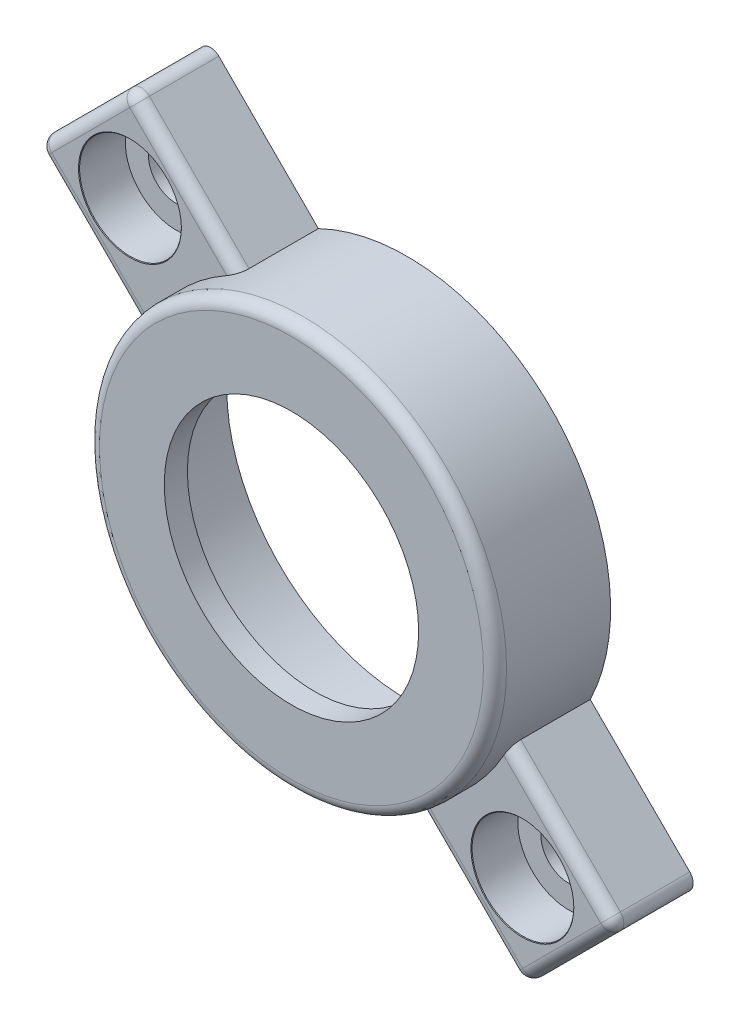
from build123d import *

# Parameters (mm, degrees)
SKETCH1_R                     = 8.8
BOSS_EXTRUDE1_DEPTH           = 5
SHELL1_T                      = -1
BOSS_EXTRUDE2_DEPTH           = 3.5
CBORE_FOR_M2_SHCS1_AT_2_COUNT = 2
CBORE_FOR_M2_SHCS1_AT_2_PITCH = 23.999204153
FILLET1_R                     = 0.5
SKETCH5_R                     = 5.5
CUT_EXTRUDE1_DEPTH            = 10


with BuildPart() as part:
    # Sketch1 → Boss-Extrude1 (new body)
    with BuildSketch(Plane.XY):
        Circle(SKETCH1_R)
    extrude(amount=BOSS_EXTRUDE1_DEPTH)

    # Shell1
    shell1_openings = [part.faces().sort_by_distance(p)[0] for p in [
        (0, 0, 0),
    ]]
    offset(amount=SHELL1_T, openings=shell1_openings, kind=Kind.INTERSECTION)

    # Sketch1<4> → Boss-Extrude2 (add)
    with BuildSketch(Plane.XY):
        with BuildLine():
            ThreePointArc((-7.919955614, 3.835922715), (-7.171229209, 5.100340344), (-6.222539674, 6.222539674))
            ThreePointArc((-6.222539674, 6.222539674), (-5.100340344, 7.171229209), (-3.835922715, 7.919955614))
            Line((-3.835922715, 7.919955614), (-8.49355603, 12.577588929))
            Line((-8.49355603, 12.577588929), (-12.577588929, 8.49355603))
            Line((-12.577588929, 8.49355603), (-7.919955614, 3.835922715))
        make_face()
        with BuildLine():
            ThreePointArc((7.919955614, -3.835922715), (7.171229209, -5.100340344), (6.222539674, -6.222539674))
            ThreePointArc((6.222539674, -6.222539674), (5.100340344, -7.171229209), (3.835922715, -7.919955614))
            Line((3.835922715, -7.919955614), (8.49355603, -12.577588929))
            Line((8.49355603, -12.577588929), (12.577588929, -8.49355603))
            Line((12.577588929, -8.49355603), (7.919955614, -3.835922715))
        make_face()
    extrude(amount=BOSS_EXTRUDE2_DEPTH)

    # Sketch4 → CBORE for M2 SHCS1 (revolve, cut)
    with BuildSketch(Plane(origin=(-8.485, 8.485, 3.5), x_dir=(0, -1, 0), z_dir=(1, 0, 0))):
        Polygon((0, 0), (0, 3.5), (1.2, 3.5), (1.2, 2), (2.2, 2), (2.2, 0.025), (2.225, 0), align=None)
    cbore_for_m2_shcs1 = revolve(axis=Axis((-8.485, 8.485, 9.85), (0, 0, -1)), mode=Mode.SUBTRACT)

    # CBORE for M2 SHCS1 at 2: CBORE for M2 SHCS1 ×2
    with Locations(*[Vector(0.7071067811865476, -0.7071067811865476, 0) * (i * CBORE_FOR_M2_SHCS1_AT_2_PITCH) for i in range(1, CBORE_FOR_M2_SHCS1_AT_2_COUNT)]):
        add(cbore_for_m2_shcs1, mode=Mode.SUBTRACT)

    # Fillet1
    fillet1_edges = [part.edges().sort_by_distance(p)[0] for p in [
        (-8.49355603, 12.577588929, 1.75),
        (-6.164739372, 10.248772271, 3.5),
        (-10.535572479, 10.535572479, 3.5),
        (-12.577588929, 8.49355603, 1.75),
        (-10.248772271, 6.164739372, 3.5),
        (12.577588929, -8.49355603, 1.75),
        (10.248772271, -6.164739372, 3.5),
        (10.535572479, -10.535572479, 3.5),
        (8.49355603, -12.577588929, 1.75),
        (6.164739372, -10.248772271, 3.5),
        (-8.8, 0, 5),
    ]]
    fillet(fillet1_edges, radius=FILLET1_R)

    # Sketch5 → Cut-Extrude1 (cut)
    with BuildSketch(Plane.XY.offset(5)):
        Circle(SKETCH5_R)
    extrude(amount=-CUT_EXTRUDE1_DEPTH, mode=Mode.SUBTRACT)


solid = part.part
